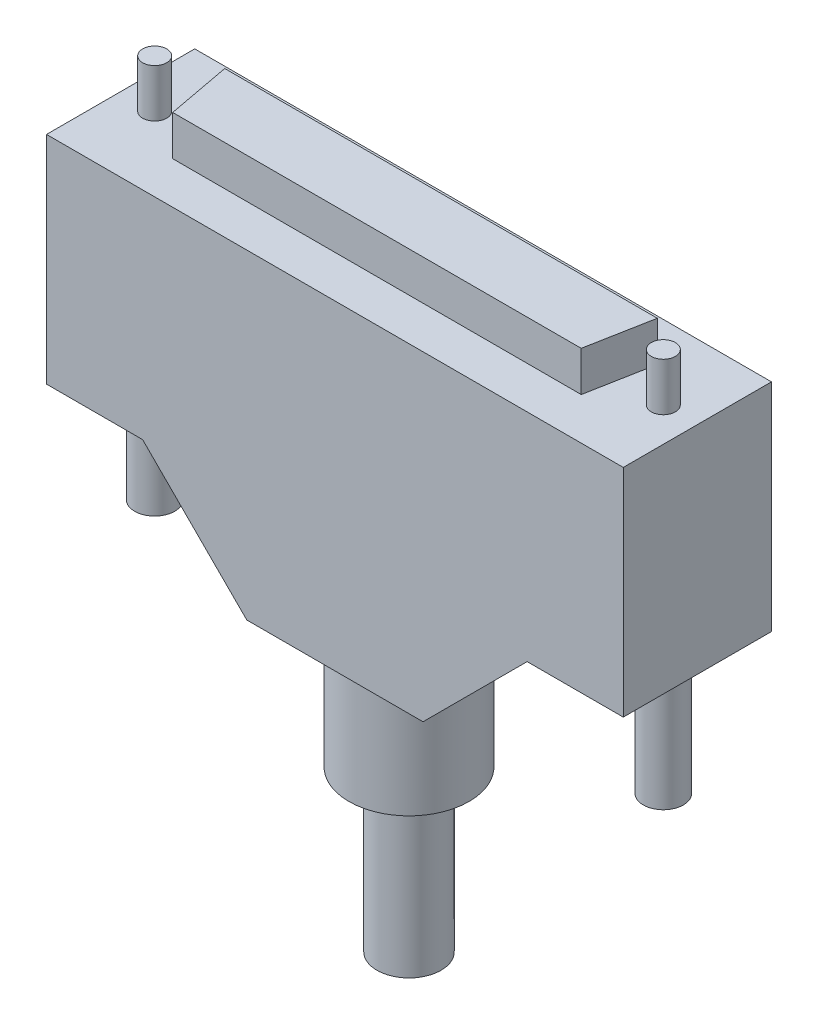
from build123d import *

# Parameters (mm, degrees)
EXTRUDE_1_DEPTH = 9.25
SKETCH_2_R      = 7.5
EXTRUDE_2_DEPTH = 15
SKETCH_3_R      = 4
EXTRUDE_3_DEPTH = 20
SKETCH_4_R      = 2.5
EXTRUDE_4_DEPTH = 15
EXTRUDE_5_DEPTH = 5
SKETCH_6_R      = 1.5
EXTRUDE_6_DEPTH = 6


with BuildPart() as part:
    # 草图1 → 凸台-拉伸1 (new, symmetric)
    with BuildSketch(Plane.XY):
        Polygon((36, 0), (-36, 0), (-36, -27), (-24, -27), (-11, -40), (11, -40), (24, -27), (36, -27), align=None)
    extrude(amount=EXTRUDE_1_DEPTH, both=True)

    # 草图2 → 凸台-拉伸2 (add)
    with BuildSketch(Plane.XZ.offset(40)):
        with Locations(Location((0, 0, 0), (0, 0, 90))):
            Circle(SKETCH_2_R)
    extrude(amount=EXTRUDE_2_DEPTH)

    # 草图3 → 凸台-拉伸3 (add)
    with BuildSketch(Plane.XZ.offset(55)):
        with Locations(Location((0, 0, 0), (0, 0, 270))):
            Circle(SKETCH_3_R)
    extrude(amount=EXTRUDE_3_DEPTH)

    # 草图4 → 凸台-拉伸4 (add)
    with BuildSketch(Plane.XZ.offset(27)):
        with Locations(Location((-31.75, 0, 0), (0, 0, 90))):
            Circle(SKETCH_4_R)
        with Locations(Location((31.75, 0, 0), (0, 0, 90))):
            Circle(SKETCH_4_R)
    extrude(amount=EXTRUDE_4_DEPTH)

    # 草图5 → 凸台-拉伸5 (add)
    with BuildSketch(Plane(origin=(0, 0, 0), x_dir=(1, 0, 0), z_dir=(0, 1, 0))):
        Polygon((-27, 4), (27, 4), (25.5, -4), (-25.5, -4), align=None)
    extrude(amount=EXTRUDE_5_DEPTH)

    # 草图6 → 凸台-拉伸6 (add)
    with BuildSketch(Plane(origin=(0, 0, 0), x_dir=(1, 0, 0), z_dir=(0, 1, 0))):
        with Locations((-31.75, 0)):
            Circle(SKETCH_6_R)
        with Locations((31.75, 0)):
            Circle(SKETCH_6_R)
    extrude(amount=EXTRUDE_6_DEPTH)


solid = part.part
